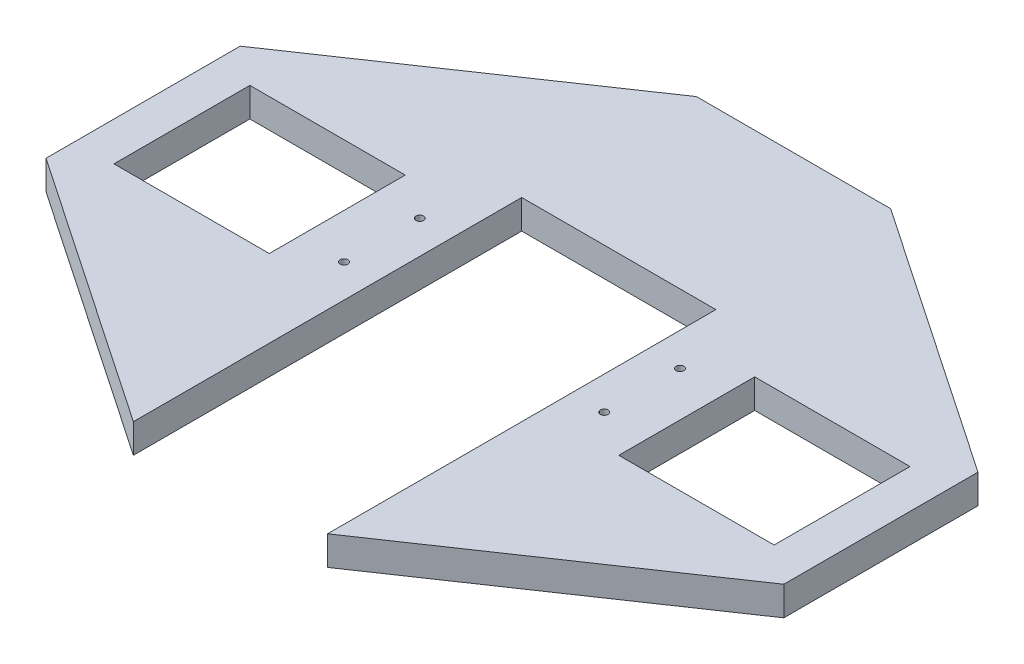
from build123d import *

# Parameters (mm, degrees)
BOSS_EXTRU_1_DEPTH      = 15
ESQUISSE6_W             = 100
ESQUISSE6_H             = 15
ENL_V_MAT_EXTRU_1_DEPTH = 200
ENL_V_MAT_EXTRU_2_REACH = 393.106
ESQUISSE7_W             = 80
ESQUISSE7_H             = 70
ENL_V_MAT_EXTRU_4_REACH = 393.106
ESQUISSE8_R             = 2


with BuildPart() as part:
    # Esquisse1 → Boss.-Extru.1 (new body)
    with BuildSketch(Plane(origin=(0, 0, 0), x_dir=(1, 0, 0), z_dir=(0, 1, 0))):
        Polygon((-76.643189126, -51.401333399), (63.356810874, 43.598666601), (163.356810874, 43.598666601), (303.356810874, -51.401333399), (303.356810874, -151.401333399), (163.356810874, -246.401333399), (63.356810874, -246.401333399), (-76.643189126, -151.401333399), align=None)
    extrude(amount=BOSS_EXTRU_1_DEPTH)

    # Esquisse6 → Enlèv. mat.-Extru.1 (cut)
    with BuildSketch(Plane.XY.offset(246.401333399)):
        with Locations((113.356810874, 7.5)):
            Rectangle(ESQUISSE6_W, ESQUISSE6_H)
    extrude(amount=-ENL_V_MAT_EXTRU_1_DEPTH, mode=Mode.SUBTRACT)

    # Esquisse7 → Enlèv. mat.-Extru.2 (cut, up to next)
    with BuildSketch(Plane(origin=(0, 15, 0), x_dir=(1, 0, 0), z_dir=(0, 1, 0)), mode=Mode.PRIVATE) as enl_v_mat_extru_2_sk1:
        with Locations((-16.643189126, -101.401333399)):
            Rectangle(ESQUISSE7_W, ESQUISSE7_H)
    enl_v_mat_extru_2_tool1 = extrude(enl_v_mat_extru_2_sk1.sketch, amount=-ENL_V_MAT_EXTRU_2_REACH, mode=Mode.PRIVATE) & part.part
    # Esquisse7 → Enlèv. mat.-Extru.2 (cut, up to next)
    with BuildSketch(Plane(origin=(0, 15, 0), x_dir=(1, 0, 0), z_dir=(0, 1, 0)), mode=Mode.PRIVATE) as enl_v_mat_extru_2_sk2:
        with Locations((243.356810874, -101.401333399)):
            Rectangle(ESQUISSE7_W, ESQUISSE7_H)
    enl_v_mat_extru_2_tool2 = extrude(enl_v_mat_extru_2_sk2.sketch, amount=-ENL_V_MAT_EXTRU_2_REACH, mode=Mode.PRIVATE) & part.part
    add(enl_v_mat_extru_2_tool1.solids().sort_by_distance((-16.643189, 15, 101.401333))[0], mode=Mode.SUBTRACT)
    add(enl_v_mat_extru_2_tool2.solids().sort_by_distance((243.356811, 15, 101.401333))[0], mode=Mode.SUBTRACT)

    # Esquisse8 → Enlèv. mat.-Extru.4 (cut, up to next)
    with BuildSketch(Plane(origin=(0, 15, 0), x_dir=(1, 0, 0), z_dir=(0, 1, 0)), mode=Mode.PRIVATE) as enl_v_mat_extru_4_sk1:
        with Locations(Location((180.356810874, -120.901333399, 0), (0, 0, 270))):
            Circle(ESQUISSE8_R)
    enl_v_mat_extru_4_tool1 = extrude(enl_v_mat_extru_4_sk1.sketch, amount=-ENL_V_MAT_EXTRU_4_REACH, mode=Mode.PRIVATE) & part.part
    # Esquisse8 → Enlèv. mat.-Extru.4 (cut, up to next)
    with BuildSketch(Plane(origin=(0, 15, 0), x_dir=(1, 0, 0), z_dir=(0, 1, 0)), mode=Mode.PRIVATE) as enl_v_mat_extru_4_sk2:
        with Locations(Location((180.356810874, -81.901333399, 0), (0, 0, 270))):
            Circle(ESQUISSE8_R)
    enl_v_mat_extru_4_tool2 = extrude(enl_v_mat_extru_4_sk2.sketch, amount=-ENL_V_MAT_EXTRU_4_REACH, mode=Mode.PRIVATE) & part.part
    # Esquisse8 → Enlèv. mat.-Extru.4 (cut, up to next)
    with BuildSketch(Plane(origin=(0, 15, 0), x_dir=(1, 0, 0), z_dir=(0, 1, 0)), mode=Mode.PRIVATE) as enl_v_mat_extru_4_sk3:
        with Locations(Location((46.356810874, -120.901333399, 0), (0, 0, 270))):
            Circle(ESQUISSE8_R)
    enl_v_mat_extru_4_tool3 = extrude(enl_v_mat_extru_4_sk3.sketch, amount=-ENL_V_MAT_EXTRU_4_REACH, mode=Mode.PRIVATE) & part.part
    # Esquisse8 → Enlèv. mat.-Extru.4 (cut, up to next)
    with BuildSketch(Plane(origin=(0, 15, 0), x_dir=(1, 0, 0), z_dir=(0, 1, 0)), mode=Mode.PRIVATE) as enl_v_mat_extru_4_sk4:
        with Locations(Location((46.356810874, -81.901333399, 0), (0, 0, 270))):
            Circle(ESQUISSE8_R)
    enl_v_mat_extru_4_tool4 = extrude(enl_v_mat_extru_4_sk4.sketch, amount=-ENL_V_MAT_EXTRU_4_REACH, mode=Mode.PRIVATE) & part.part
    add(enl_v_mat_extru_4_tool1.solids().sort_by_distance((180.356811, 15, 120.901333))[0], mode=Mode.SUBTRACT)
    add(enl_v_mat_extru_4_tool2.solids().sort_by_distance((180.356811, 15, 81.901333))[0], mode=Mode.SUBTRACT)
    add(enl_v_mat_extru_4_tool3.solids().sort_by_distance((46.356811, 15, 120.901333))[0], mode=Mode.SUBTRACT)
    add(enl_v_mat_extru_4_tool4.solids().sort_by_distance((46.356811, 15, 81.901333))[0], mode=Mode.SUBTRACT)


solid = part.part
